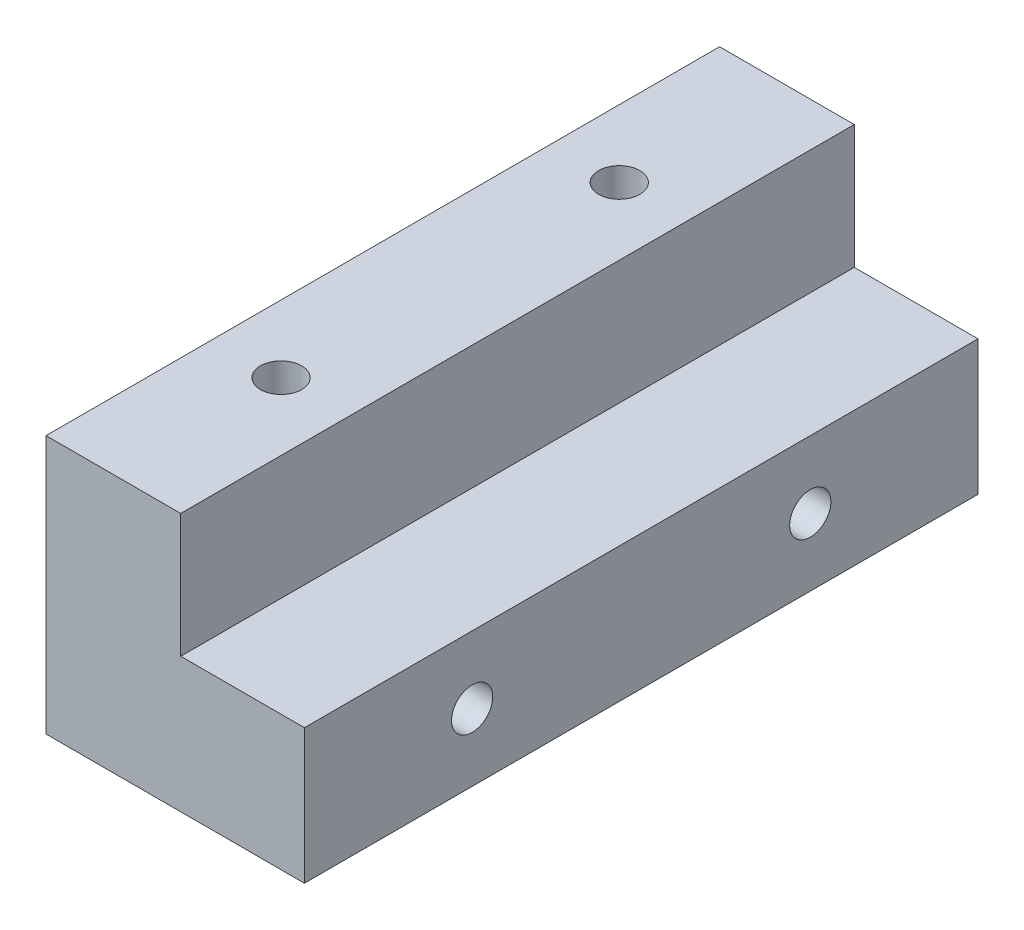
from build123d import *

# Parameters (mm, degrees)
EXTRUDE_1_DEPTH     = 24.5
SKETCH_2_R          = 0.75
CUT_EXTRUDE_1_DEPTH = 5
SKETCH_3_R          = 0.75
CUT_EXTRUDE_2_DEPTH = 5


with BuildPart() as part:
    # 草圖1 → 填料-伸長1 (new body)
    with BuildSketch(Plane.XY):
        Polygon((0, 9.4), (0, 0), (9.4, 0), (9.4, 4.9), (4.9, 4.9), (4.9, 9.4), align=None)
    extrude(amount=EXTRUDE_1_DEPTH)

    # 草圖2 → 除料-伸長1 (cut)
    with BuildSketch(Plane(origin=(9.4, 0, 0), x_dir=(0, 0, -1), z_dir=(1, 0, 0))):
        with Locations(Location((-6.1, 2.45, 0), (0, 0, 90))):
            Circle(SKETCH_2_R)
        with Locations(Location((-18.4, 2.45, 0), (0, 0, 90))):
            Circle(SKETCH_2_R)
    extrude(amount=-CUT_EXTRUDE_1_DEPTH, mode=Mode.SUBTRACT)

    # 草圖3 → 除料-伸長2 (cut)
    with BuildSketch(Plane(origin=(0, 9.4, 0), x_dir=(1, 0, 0), z_dir=(0, 1, 0))):
        with Locations(Location((2.45, -6.1, 0), (0, 0, 180))):
            Circle(SKETCH_3_R)
        with Locations(Location((2.45, -18.4, 0), (0, 0, 180))):
            Circle(SKETCH_3_R)
    extrude(amount=-CUT_EXTRUDE_2_DEPTH, mode=Mode.SUBTRACT)


solid = part.part
